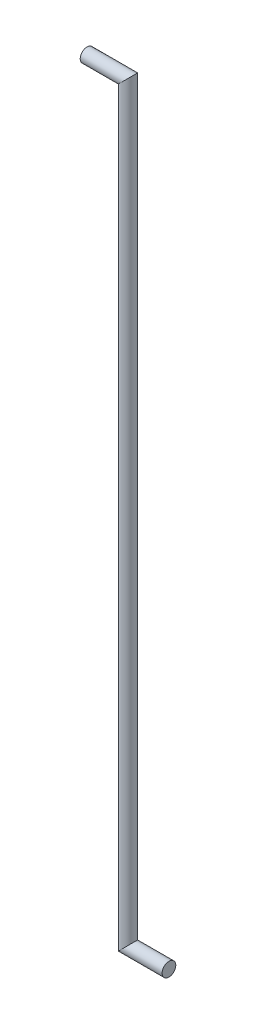
from build123d import *

# Parameters (mm, degrees)
SWEEP1_PROFILE_R = 0.5


with BuildPart() as part:
    # Sweep1: sweep along a path in Sketch1
    with BuildLine(Plane.XY) as sweep1_path:
        Line((-3, 27.5), (0, 27.5))
        Line((0, 27.5), (0, -27.5))
        Line((0, -27.5), (3, -27.5))
    # Sweep1 profile (on start of the path) → Sweep1 (sweep)
    with BuildSketch(Plane(origin=(-3, 27.5, 0), x_dir=(0, 0, 1), z_dir=(1, 0, 0))):
        Circle(SWEEP1_PROFILE_R)
    sweep(path=sweep1_path.line, transition=Transition.RIGHT)


solid = part.part
